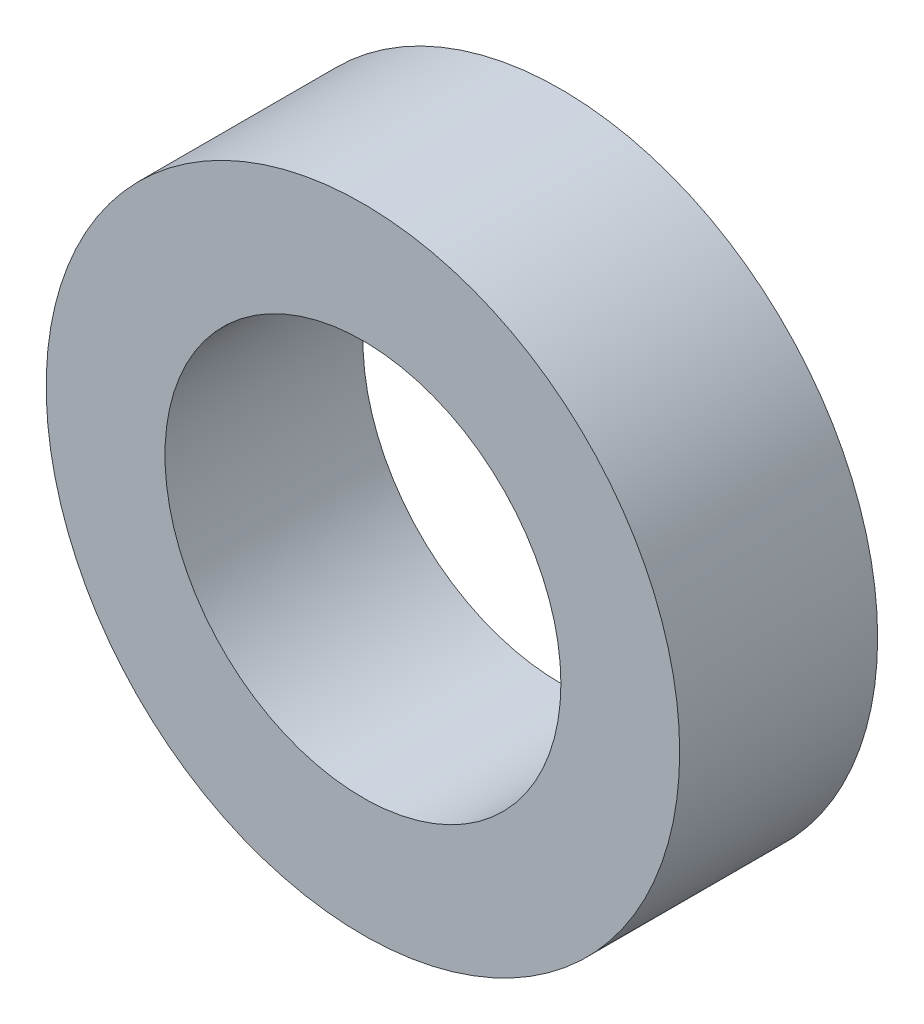
from build123d import *

# Parameters (mm, degrees)
SKETCH1_R           = 4
SKETCH1_R_2         = 2.5
BOSS_EXTRUDE1_DEPTH = 2.5


with BuildPart() as part:
    # Sketch1 → Boss-Extrude1 (new body)
    with BuildSketch(Plane.XY):
        Circle(SKETCH1_R)
        Circle(SKETCH1_R_2, mode=Mode.SUBTRACT)
    extrude(amount=BOSS_EXTRUDE1_DEPTH)


solid = part.part
